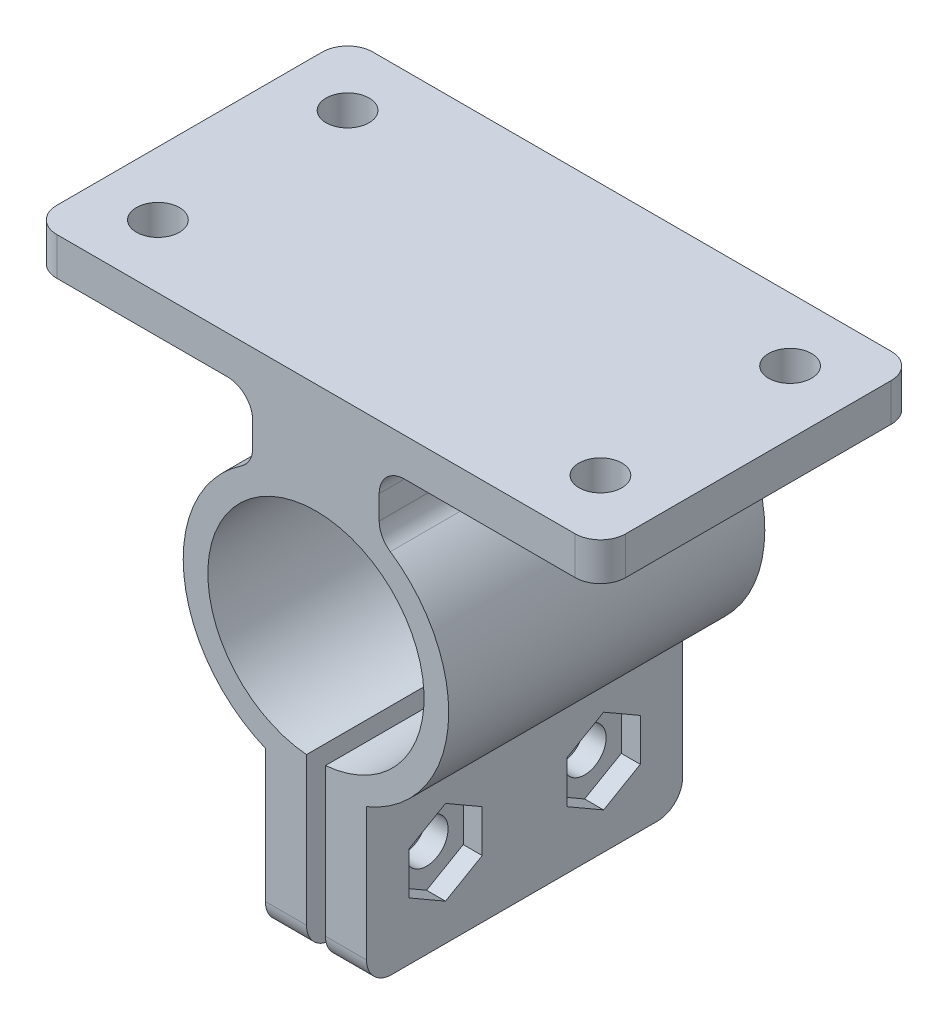
from build123d import *

# Parameters (mm, degrees)
SKETCH1_W           = 45
SKETCH1_H           = 25
SKETCH1_R           = 1.7
BOSS_EXTRUDE1_DEPTH = 3
SKETCH2_W           = 10
SKETCH2_H           = 25
BOSS_EXTRUDE2_DEPTH = 5
BOSS_EXTRUDE3_DEPTH = 25
CUT_EXTRUDE1_DEPTH  = 50.590533486
SKETCH5_R           = 1.7
CUT_EXTRUDE2_DEPTH  = 47.75971569
CUT_EXTRUDE3_DEPTH  = 1.5
FILLET1_R           = 2
FILLET2_R           = 2
FILLET3_R           = 2


with BuildPart() as part:
    # Sketch1 → Boss-Extrude1 (new body)
    with BuildSketch(Plane(origin=(0, 0, 0), x_dir=(1, 0, 0), z_dir=(0, 1, 0))):
        Rectangle(SKETCH1_W, SKETCH1_H)
        with Locations(Location((-17.5, 7.5, 0), (0, 0, 270))):
            Circle(SKETCH1_R, mode=Mode.SUBTRACT)
        with Locations(Location((17.5, 7.5, 0), (0, 0, 270))):
            Circle(SKETCH1_R, mode=Mode.SUBTRACT)
        with Locations(Location((17.5, -7.5, 0), (0, 0, 270))):
            Circle(SKETCH1_R, mode=Mode.SUBTRACT)
        with Locations(Location((-17.5, -7.5, 0), (0, 0, 270))):
            Circle(SKETCH1_R, mode=Mode.SUBTRACT)
    extrude(amount=BOSS_EXTRUDE1_DEPTH)

    # Sketch2 → Boss-Extrude2 (add)
    with BuildSketch(Plane.XZ):
        Rectangle(SKETCH2_W, SKETCH2_H)
    extrude(amount=BOSS_EXTRUDE2_DEPTH)

    # Sketch3 → Boss-Extrude3 (add)
    with BuildSketch(Plane.XY.offset(12.5)):
        with BuildLine():
            Line((4, -23.941336576), (4, -36.441336576))
            Line((4, -36.441336576), (-4, -36.441336576))
            Line((-4, -36.441336576), (-4, -23.941336576))
            ThreePointArc((-4, -23.941336576), (-10.485397361, -14.786664856), (-5, -5))
            Line((-5, -5), (5, -5))
            ThreePointArc((5, -5), (10.485397361, -14.786664856), (4, -23.941336576))
        make_face()
    extrude(amount=-BOSS_EXTRUDE3_DEPTH)

    # Sketch4 → Cut-Extrude1 (cut, through all)
    with BuildSketch(Plane.XY.offset(12.5)):
        with BuildLine():
            Line((-0.75, -22.750134396), (-0.75, -36.441336576))
            Line((-0.75, -36.441336576), (0.75, -36.441336576))
            Line((0.75, -36.441336576), (0.75, -22.750134396))
            ThreePointArc((0.75, -22.750134396), (0, -5.683092656), (-0.75, -22.750134396))
        make_face()
    extrude(amount=-CUT_EXTRUDE1_DEPTH, mode=Mode.SUBTRACT)

    # Sketch5 → Cut-Extrude2 (cut, through all)
    with BuildSketch(Plane(origin=(4, 0, 0), x_dir=(0, 0, -1), z_dir=(1, 0, 0))):
        with Locations(Location((-6.25, -30.191336576, 0), (0, 0, 180))):
            Circle(SKETCH5_R)
        with Locations(Location((6.25, -30.191336576, 0), (0, 0, 180))):
            Circle(SKETCH5_R)
    extrude(amount=-CUT_EXTRUDE2_DEPTH, mode=Mode.SUBTRACT)

    # Sketch6 → Cut-Extrude3 (cut)
    with BuildSketch(Plane(origin=(4, 0, 0), x_dir=(0, 0, -1), z_dir=(1, 0, 0))):
        Polygon((9.15, -28.517020795), (6.25, -26.842705014), (3.35, -28.517020795), (3.35, -31.865652356), (6.25, -33.539968137), (9.15, -31.865652356), align=None)
        Polygon((-3.35, -28.517020795), (-6.25, -26.842705014), (-9.15, -28.517020795), (-9.15, -31.865652356), (-6.25, -33.539968137), (-3.35, -31.865652356), align=None)
    extrude(amount=-CUT_EXTRUDE3_DEPTH, mode=Mode.SUBTRACT)

    # Fillet1
    fillet1_edges = [part.edges().sort_by_distance(p)[0] for p in [
        (-22.5, 1.5, -12.5),
        (22.5, 1.5, -12.5),
        (22.5, 1.5, 12.5),
        (-22.5, 1.5, 12.5),
    ]]
    fillet(fillet1_edges, radius=FILLET1_R)

    # Fillet2
    fillet2_edges = [part.edges().sort_by_distance(p)[0] for p in [
        (-5, 0, 0),
        (5, 0, 0),
        (-5, -5, 0),
        (5, -5, 0),
    ]]
    fillet(fillet2_edges, radius=FILLET2_R)

    # Fillet3
    fillet3_edges = [part.edges().sort_by_distance(p)[0] for p in [
        (-2.375, -36.441336576, 12.5),
        (2.375, -36.441336576, -12.5),
        (-2.375, -36.441336576, -12.5),
        (2.375, -36.441336576, 12.5),
    ]]
    fillet(fillet3_edges, radius=FILLET3_R)


solid = part.part
